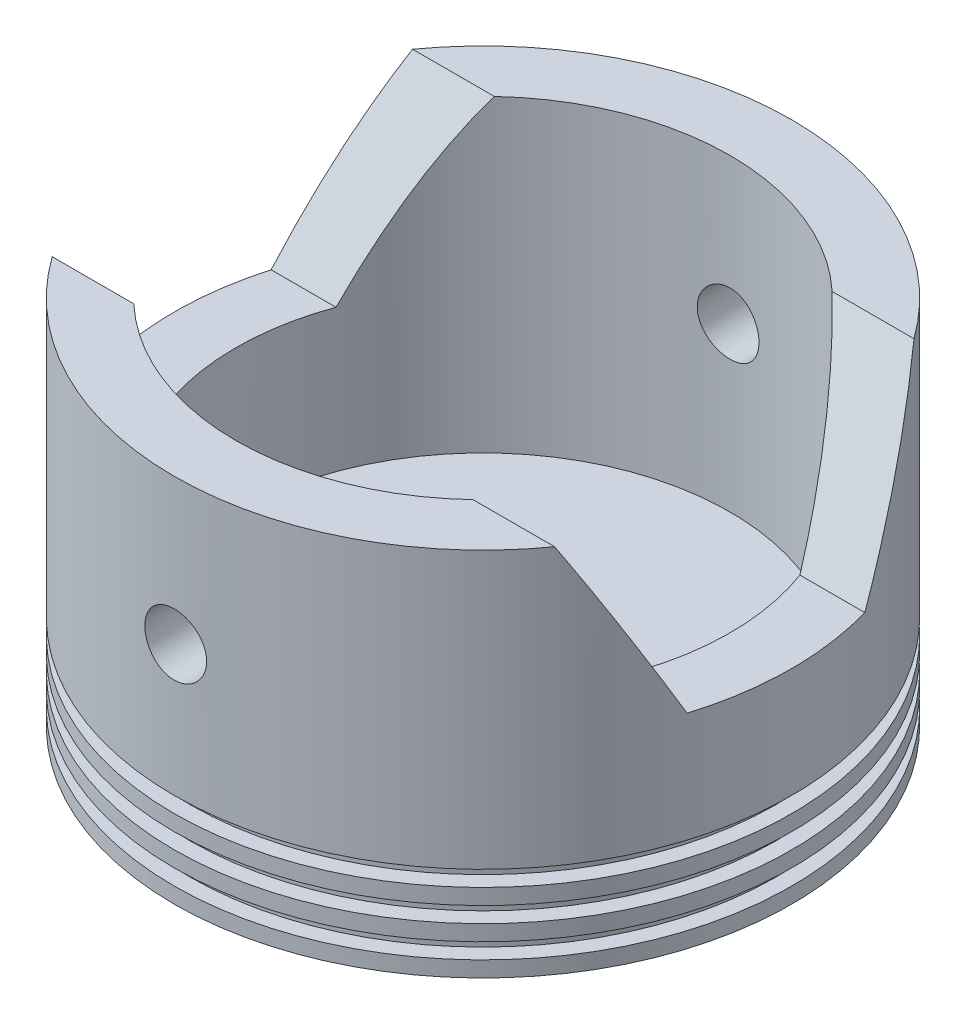
from build123d import *

# Parameters (mm, degrees)
SKETCH1_R               = 25
BOSS_EXTRUDE1_DEPTH     = 30
SKETCH2_W               = 1.27
SKETCH2_H               = 1.27
SKETCH10_R              = 20
CUT_EXTRUDE1_DEPTH      = 25
CUT_EXTRUDE2_DEPTH      = 47.368092477
CUT_EXTRUDE2_DEPTH_BACK = 47.368092477
CUT_EXTRUDE3_DEPTH      = 47.368092477
CUT_EXTRUDE3_DEPTH_BACK = 47.368092477
SKETCH12_R              = 2.5


with BuildPart() as part:
    # Sketch1 → Boss-Extrude1 (new body)
    with BuildSketch(Plane(origin=(0, 0, 0), x_dir=(1, 0, 0), z_dir=(0, 1, 0))):
        Circle(SKETCH1_R)
    extrude(amount=BOSS_EXTRUDE1_DEPTH)

    # Sketch2 → Cut-Revolve1 (revolve, cut)
    with BuildSketch(Plane.XY):
        with Locations((24.365, 1.905)):
            Rectangle(SKETCH2_W, SKETCH2_H)
        with Locations((24.365, 4.445)):
            Rectangle(SKETCH2_W, SKETCH2_H)
        with Locations((24.365, 6.985)):
            Rectangle(SKETCH2_W, SKETCH2_H)
    revolve(axis=Axis((0, 0, 0), (0, 1, 0)), mode=Mode.SUBTRACT)

    # Sketch10 → Cut-Extrude1 (cut)
    with BuildSketch(Plane(origin=(0, 30, 0), x_dir=(1, 0, 0), z_dir=(0, 1, 0))):
        Circle(SKETCH10_R)
    extrude(amount=-CUT_EXTRUDE1_DEPTH, mode=Mode.SUBTRACT)

    # Sketch11 → Cut-Extrude2 (cut, two sides: drawn at the far end of the back side and taken through both)
    with BuildSketch(Plane(origin=(0, 0, 0), x_dir=(0, 0, -1), z_dir=(1, 0, 0)).offset(-CUT_EXTRUDE2_DEPTH_BACK)):
        Polygon((0, 16.523537724), (6.878930104, 16.523537724), (14.594122298, 30), (-14.540169905, 30), (-7.36450164, 16.523537724), align=None)
    extrude(amount=CUT_EXTRUDE2_DEPTH + CUT_EXTRUDE2_DEPTH_BACK, mode=Mode.SUBTRACT)

    # Sketch12 → Cut-Extrude3 (cut, two sides: drawn at the far end of the back side and taken through both)
    with BuildSketch(Plane.XY.offset(-CUT_EXTRUDE3_DEPTH_BACK)):
        with Locations((0, 18.210167382)):
            Circle(SKETCH12_R)
    extrude(amount=CUT_EXTRUDE3_DEPTH + CUT_EXTRUDE3_DEPTH_BACK, mode=Mode.SUBTRACT)


solid = part.part
